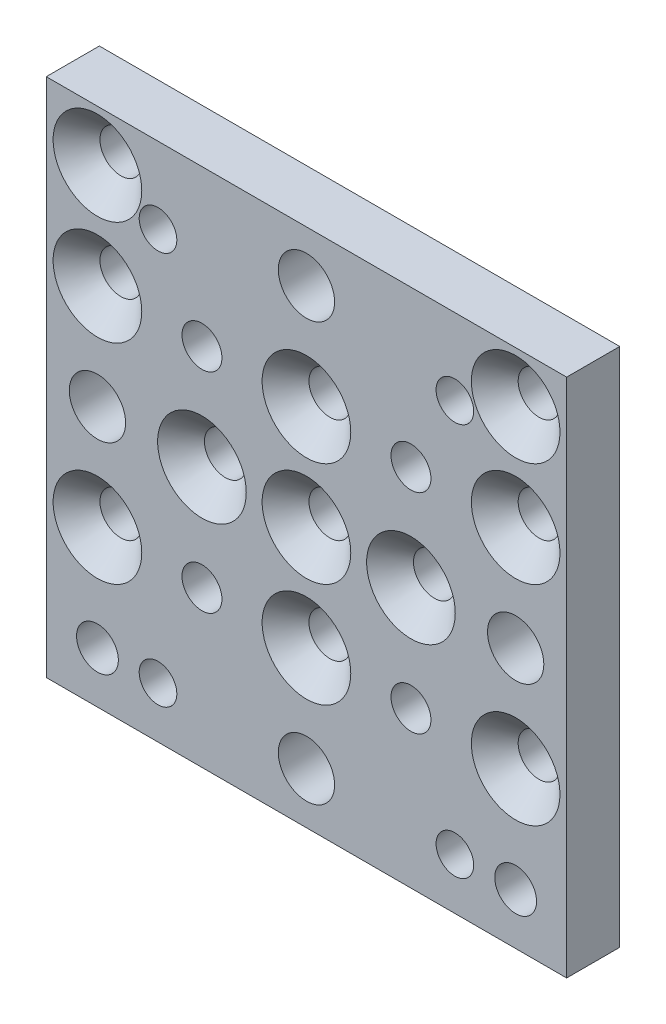
from build123d import *

# Parameters (mm, degrees)
SKETCH1_W           = 62.23
SKETCH1_H           = 62.23
SKETCH1_R           = 2.5
SKETCH1_R_2         = 2.25
BOSS_EXTRUDE1_DEPTH = 6.35
CHAMFER1_SIZE       = 2.8
SKETCH2_R           = 3.3655
SKETCH2_R_2         = 2.3876
CUT_EXTRUDE2_DEPTH  = 45.459070503


with BuildPart() as part:
    # Sketch1 → Boss-Extrude1 (new body)
    with BuildSketch(Plane.XY):
        Rectangle(SKETCH1_W, SKETCH1_H)
        with Locations((25.019, 25.0063)):
            Circle(SKETCH1_R, mode=Mode.SUBTRACT)
        with Locations((25.019, 12.4968)):
            Circle(SKETCH1_R, mode=Mode.SUBTRACT)
        with Locations((25.019, -12.4968)):
            Circle(SKETCH1_R, mode=Mode.SUBTRACT)
        with Locations((25.019, -24.9936)):
            Circle(SKETCH1_R, mode=Mode.SUBTRACT)
        with Locations((12.4968, 0)):
            Circle(SKETCH1_R, mode=Mode.SUBTRACT)
        with Locations((0, 12.4968)):
            Circle(SKETCH1_R, mode=Mode.SUBTRACT)
        Circle(SKETCH1_R, mode=Mode.SUBTRACT)
        with Locations((0, -12.4968)):
            Circle(SKETCH1_R, mode=Mode.SUBTRACT)
        with Locations((-24.9936, -24.9936)):
            Circle(SKETCH1_R, mode=Mode.SUBTRACT)
        with Locations((-24.9936, -12.4968)):
            Circle(SKETCH1_R, mode=Mode.SUBTRACT)
        with Locations((-12.4968, 0)):
            Circle(SKETCH1_R, mode=Mode.SUBTRACT)
        with Locations((-24.9936, 25.0063)):
            Circle(SKETCH1_R, mode=Mode.SUBTRACT)
        with Locations((-24.9936, 12.4968)):
            Circle(SKETCH1_R, mode=Mode.SUBTRACT)
        with Locations((-17.75, 22)):
            Circle(SKETCH1_R_2, mode=Mode.SUBTRACT)
        with Locations((17.75, 22)):
            Circle(SKETCH1_R_2, mode=Mode.SUBTRACT)
        with Locations((17.75, -25)):
            Circle(SKETCH1_R_2, mode=Mode.SUBTRACT)
        with Locations((-17.75, -25)):
            Circle(SKETCH1_R_2, mode=Mode.SUBTRACT)
    extrude(amount=BOSS_EXTRUDE1_DEPTH)

    # Chamfer1
    chamfer1_edges = [part.edges().sort_by_distance(p)[0] for p in [
        (22.519, 25.0063, 6.35),
        (22.519, 12.4968, 6.35),
        (22.519, -12.4968, 6.35),
        (9.9968, 0, 6.35),
        (-2.5, 12.4968, 6.35),
        (-2.5, 0, 6.35),
        (-2.5, -12.4968, 6.35),
        (-27.4936, -12.4968, 6.35),
        (-14.9968, 0, 6.35),
        (-27.4936, 25.0063, 6.35),
        (-27.4936, 12.4968, 6.35),
    ]]
    chamfer(chamfer1_edges, length=CHAMFER1_SIZE)

    # Sketch2 → Cut-Extrude2 (cut, through all)
    with BuildSketch(Plane.XY.offset(6.35)):
        with Locations((0, -24.9936)):
            Circle(SKETCH2_R)
        with Locations((0, 25.019)):
            Circle(SKETCH2_R)
        with Locations((12.4968, 12.4968)):
            Circle(SKETCH2_R_2)
        with Locations((-12.4968, 12.4968)):
            Circle(SKETCH2_R_2)
        with Locations((-12.4968, -12.4968)):
            Circle(SKETCH2_R_2)
        with Locations((12.4968, -12.4968)):
            Circle(SKETCH2_R_2)
        with Locations((25.019, 0)):
            Circle(SKETCH2_R)
        with Locations((-24.9936, 0)):
            Circle(SKETCH2_R)
    extrude(amount=-CUT_EXTRUDE2_DEPTH, mode=Mode.SUBTRACT)


solid = part.part
